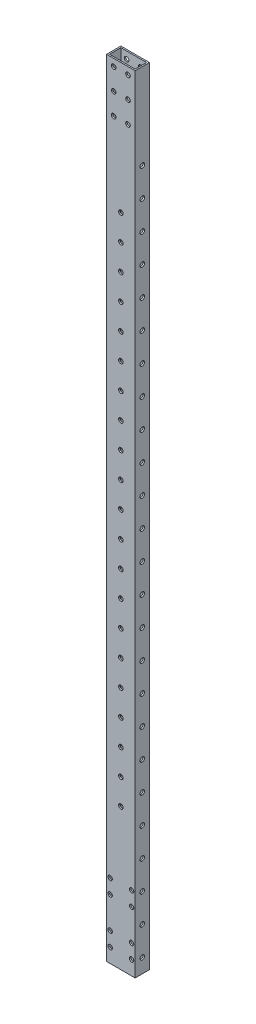
from build123d import *

# Parameters (mm, degrees)
SKETCH_1_W          = 20
SKETCH_1_H          = 10
SKETCH_1_W_2        = 18
SKETCH_1_H_2        = 8
EXTRUDE_1_DEPTH     = 500
SKETCH_2_R          = 1.55
CUT_EXTRUDE_1_DEPTH = 501.199960016
SKETCH_3_R          = 1.6
CUT_EXTRUDE_2_DEPTH = 501.424819528
SKETCH_4_W          = 20
SKETCH_4_H          = 10
SKETCH_4_W_2        = 18
SKETCH_4_H_2        = 8
EXTRUDE_2_DEPTH     = 50
SKETCH_5_R          = 1.6
CUT_EXTRUDE_3_DEPTH = 551.181788143
SKETCH_6_R          = 1.6
CUT_EXTRUDE_4_DEPTH = 551.181788143


with BuildPart() as part:
    # 草图1 → 拉伸-薄壁1 (new body)
    with BuildSketch(Plane(origin=(0, 0, 0), x_dir=(1, 0, 0), z_dir=(0, 1, 0))):
        Rectangle(SKETCH_1_W, SKETCH_1_H)
        Rectangle(SKETCH_1_W_2, SKETCH_1_H_2, mode=Mode.SUBTRACT)
    extrude(amount=EXTRUDE_1_DEPTH)

    # 草图2 → 切除-拉伸1 (cut, through all)
    with BuildSketch(Plane(origin=(0, 0, -5), x_dir=(-1, 0, 0), z_dir=(0, 0, -1))):
        with Locations((-7.5, 20)):
            Circle(SKETCH_2_R)
        with Locations(Location((-7.5, 10, 0), (0, 0, 180))):
            Circle(SKETCH_2_R)
        with Locations((7.5, 10)):
            Circle(SKETCH_2_R)
        with Locations(Location((7.5, 20, 0), (0, 0, 180))):
            Circle(SKETCH_2_R)
        with Locations((-7.5, 51.9)):
            Circle(SKETCH_2_R)
        with Locations(Location((-7.5, 41.9, 0), (0, 0, 180))):
            Circle(SKETCH_2_R)
        with Locations((7.5, 41.9)):
            Circle(SKETCH_2_R)
        with Locations(Location((7.5, 51.9, 0), (0, 0, 180))):
            Circle(SKETCH_2_R)
    extrude(amount=-CUT_EXTRUDE_1_DEPTH, mode=Mode.SUBTRACT)

    # 草图3 → 切除-拉伸2 (cut, through all)
    with BuildSketch(Plane.ZY.offset(10)):
        with Locations((0, 10)):
            Circle(SKETCH_3_R)
        with Locations((0, 30)):
            Circle(SKETCH_3_R)
        with Locations((0, 50)):
            Circle(SKETCH_3_R)
        with Locations((0, 70)):
            Circle(SKETCH_3_R)
        with Locations((0, 90)):
            Circle(SKETCH_3_R)
        with Locations((0, 110)):
            Circle(SKETCH_3_R)
        with Locations((0, 130)):
            Circle(SKETCH_3_R)
        with Locations((0, 150)):
            Circle(SKETCH_3_R)
        with Locations((0, 170)):
            Circle(SKETCH_3_R)
        with Locations((0, 190)):
            Circle(SKETCH_3_R)
        with Locations((0, 210)):
            Circle(SKETCH_3_R)
        with Locations((0, 230)):
            Circle(SKETCH_3_R)
        with Locations((0, 250)):
            Circle(SKETCH_3_R)
        with Locations((0, 270)):
            Circle(SKETCH_3_R)
        with Locations((0, 290)):
            Circle(SKETCH_3_R)
        with Locations((0, 310)):
            Circle(SKETCH_3_R)
        with Locations((0, 330)):
            Circle(SKETCH_3_R)
        with Locations((0, 350)):
            Circle(SKETCH_3_R)
        with Locations((0, 370)):
            Circle(SKETCH_3_R)
        with Locations((0, 390)):
            Circle(SKETCH_3_R)
        with Locations((0, 410)):
            Circle(SKETCH_3_R)
        with Locations((0, 430)):
            Circle(SKETCH_3_R)
        with Locations((0, 450)):
            Circle(SKETCH_3_R)
        with Locations((0, 470)):
            Circle(SKETCH_3_R)
        with Locations((0, 490)):
            Circle(SKETCH_3_R)
    extrude(amount=-CUT_EXTRUDE_2_DEPTH, mode=Mode.SUBTRACT)

    # 草图4 → 拉伸-薄壁2 (add)
    with BuildSketch(Plane(origin=(0, 500, 0), x_dir=(1, 0, 0), z_dir=(0, 1, 0))):
        Rectangle(SKETCH_4_W, SKETCH_4_H)
        Rectangle(SKETCH_4_W_2, SKETCH_4_H_2, mode=Mode.SUBTRACT)
    extrude(amount=EXTRUDE_2_DEPTH)

    # 草图5 → 切除-拉伸3 (cut, through all)
    with BuildSketch(Plane(origin=(0, 0, -5), x_dir=(-1, 0, 0), z_dir=(0, 0, -1))):
        with Locations((-5, 530)):
            Circle(SKETCH_5_R)
        with Locations((-5, 545)):
            Circle(SKETCH_5_R)
        with Locations((-5, 515)):
            Circle(SKETCH_5_R)
        with Locations((5, 515)):
            Circle(SKETCH_5_R)
        with Locations((5, 545)):
            Circle(SKETCH_5_R)
        with Locations((5, 530)):
            Circle(SKETCH_5_R)
    extrude(amount=-CUT_EXTRUDE_3_DEPTH, mode=Mode.SUBTRACT)

    # 草图6 → 切除-拉伸4 (cut, through all)
    with BuildSketch(Plane(origin=(0, 0, -5), x_dir=(-1, 0, 0), z_dir=(0, 0, -1))):
        with Locations((0.016107147, 279)):
            Circle(SKETCH_6_R)
        with Locations((0, 296.999992793)):
            Circle(SKETCH_6_R)
        with Locations((0, 261.000007207)):
            Circle(SKETCH_6_R)
        with Locations((0, 243.000007207)):
            Circle(SKETCH_6_R)
        with Locations((0, 225.000007207)):
            Circle(SKETCH_6_R)
        with Locations((0, 207.000007207)):
            Circle(SKETCH_6_R)
        with Locations((0, 189.000007207)):
            Circle(SKETCH_6_R)
        with Locations((0, 171.000007207)):
            Circle(SKETCH_6_R)
        with Locations((0, 153.000007207)):
            Circle(SKETCH_6_R)
        with Locations((0, 135.000007207)):
            Circle(SKETCH_6_R)
        with Locations((0, 117.000007207)):
            Circle(SKETCH_6_R)
        with Locations((0, 99.000007207)):
            Circle(SKETCH_6_R)
        with Locations((0, 314.999992793)):
            Circle(SKETCH_6_R)
        with Locations((0, 332.999992793)):
            Circle(SKETCH_6_R)
        with Locations((0, 350.999992793)):
            Circle(SKETCH_6_R)
        with Locations((0, 368.999992793)):
            Circle(SKETCH_6_R)
        with Locations((0, 386.999992793)):
            Circle(SKETCH_6_R)
        with Locations((0, 404.999992793)):
            Circle(SKETCH_6_R)
        with Locations((0, 422.999992793)):
            Circle(SKETCH_6_R)
        with Locations((0, 440.999992793)):
            Circle(SKETCH_6_R)
        with Locations((0, 458.999992793)):
            Circle(SKETCH_6_R)
    extrude(amount=-CUT_EXTRUDE_4_DEPTH, mode=Mode.SUBTRACT)


solid = part.part
